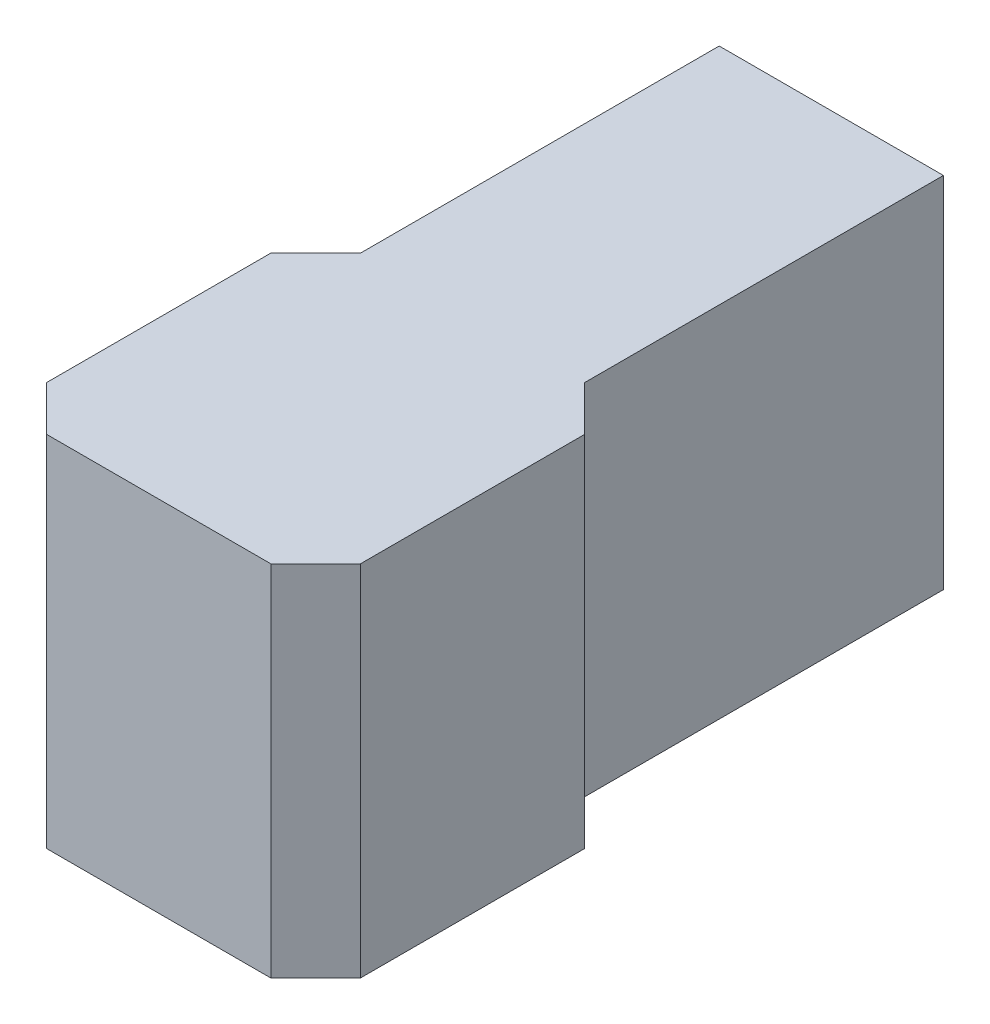
from build123d import *

# Parameters (mm, degrees)
SKETCH1_W           = 70
SKETCH1_H           = 70
BOSS_EXTRUDE1_DEPTH = 80
CHAMFER1_SIZE       = 10
SKETCH2_W           = 9
SKETCH2_H           = 35
CUT_EXTRUDE1_DEPTH  = 40
SKETCH3_W           = 50
SKETCH3_H           = 80
BOSS_EXTRUDE2_DEPTH = 80


with BuildPart() as part:
    # Sketch1 → Boss-Extrude1 (new body)
    with BuildSketch(Plane(origin=(0, 0, 0), x_dir=(1, 0, 0), z_dir=(0, 1, 0))):
        Rectangle(SKETCH1_W, SKETCH1_H)
    extrude(amount=BOSS_EXTRUDE1_DEPTH)

    # Chamfer1
    chamfer1_edges = [part.edges().sort_by_distance(p)[0] for p in [
        (35, 40, 35),
        (-35, 40, 35),
        (-35, 40, -35),
        (35, 40, -35),
    ]]
    chamfer(chamfer1_edges, length=CHAMFER1_SIZE)

    # Sketch2 → Cut-Extrude1 (cut)
    with BuildSketch(Plane(origin=(0, 0, -35), x_dir=(-1, 0, 0), z_dir=(0, 0, -1))):
        Polygon((-6, 60), (-4.5, 60), (4.5, 60), (6, 60), (6, 70), (-6, 70), align=None)
        with Locations((0, 42.5)):
            Rectangle(SKETCH2_W, SKETCH2_H)
    extrude(amount=-CUT_EXTRUDE1_DEPTH, mode=Mode.SUBTRACT)

    # Sketch3 → Boss-Extrude2 (add)
    with BuildSketch(Plane(origin=(0, 0, -35), x_dir=(-1, 0, 0), z_dir=(0, 0, -1))):
        with Locations((0, 40)):
            Rectangle(SKETCH3_W, SKETCH3_H)
        Polygon((-6, 60), (-6, 70), (6, 70), (6, 60), (4.5, 60), (4.5, 25), (-4.5, 25), (-4.5, 60), align=None, mode=Mode.SUBTRACT)
    extrude(amount=BOSS_EXTRUDE2_DEPTH)


solid = part.part
